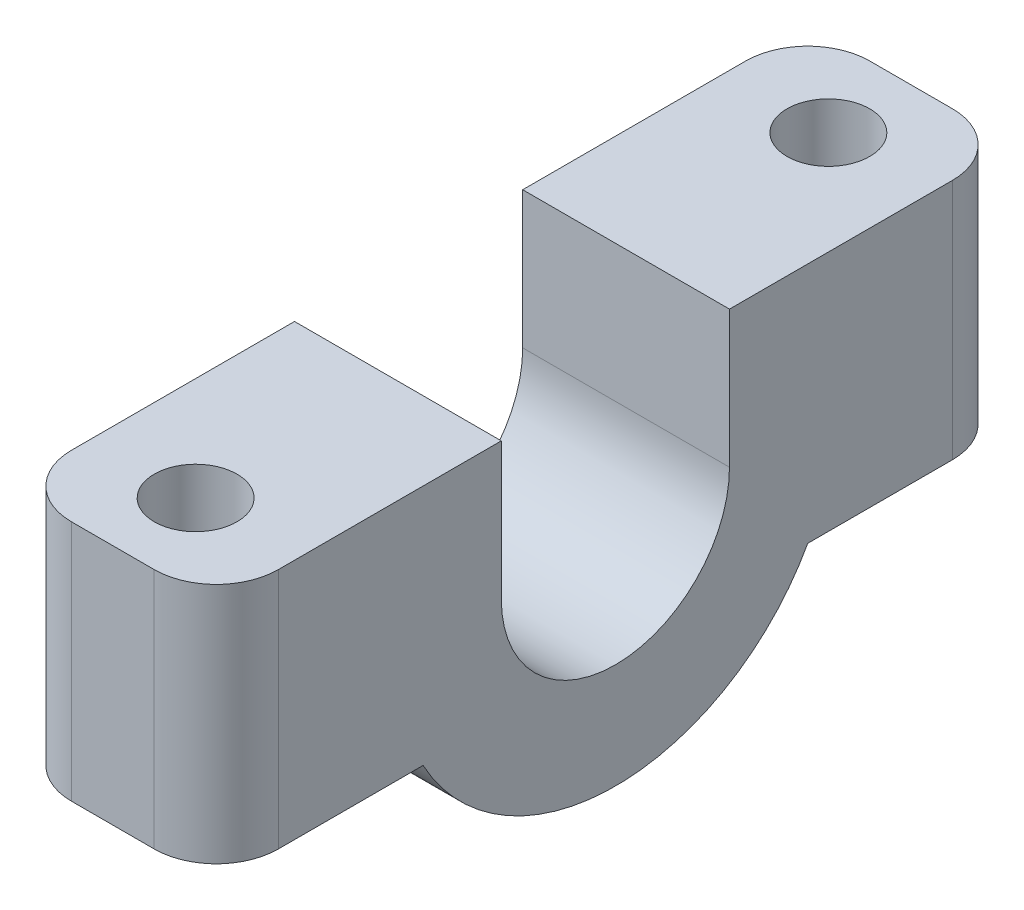
from build123d import *

# Parameters (mm, degrees)
BOSS_EXTRUDE1_DEPTH = 20
CUT_EXTRUDE1_REACH  = 57.463
SKETCH3_R           = 4
FILLET1_R           = 6


with BuildPart() as part:
    # Sketch2 → Boss-Extrude1 (new body)
    with BuildSketch(Plane(origin=(0, 0, 0), x_dir=(0, 0, -1), z_dir=(1, 0, 0))):
        with BuildLine():
            Line((-18.601140422, -10.16), (-38.601140422, -10.16))
            Line((-38.601140422, -10.16), (-38.601140422, 0))
            Line((-38.601140422, 0), (-38.601140422, 13.245))
            Line((-38.601140422, 13.245), (-11.035, 13.245))
            Line((-11.035, 13.245), (-11.035, 0))
            ThreePointArc((-11.035, 0), (0, -11.035), (11.035, 0))
            Line((11.035, 0), (11.035, 13.245))
            Line((11.035, 13.245), (38.601140422, 13.245))
            Line((38.601140422, 13.245), (38.601140422, -10.16))
            Line((38.601140422, -10.16), (18.601140422, -10.16))
            ThreePointArc((18.601140422, -10.16), (0, -21.195), (-18.601140422, -10.16))
        make_face()
    extrude(amount=BOSS_EXTRUDE1_DEPTH)

    # Sketch3 → Cut-Extrude1 (cut, up to next)
    with BuildSketch(Plane(origin=(0, 13.245, 0), x_dir=(1, 0, 0), z_dir=(0, 1, 0)), mode=Mode.PRIVATE) as cut_extrude1_sk1:
        with Locations(Location((10, -30.6, 0), (0, 0, 270))):
            Circle(SKETCH3_R)
    cut_extrude1_tool1 = extrude(cut_extrude1_sk1.sketch, amount=-CUT_EXTRUDE1_REACH, mode=Mode.PRIVATE) & part.part
    # Sketch3 → Cut-Extrude1 (cut, up to next)
    with BuildSketch(Plane(origin=(0, 13.245, 0), x_dir=(1, 0, 0), z_dir=(0, 1, 0)), mode=Mode.PRIVATE) as cut_extrude1_sk2:
        with Locations(Location((10, 30.6, 0), (0, 0, 270))):
            Circle(SKETCH3_R)
    cut_extrude1_tool2 = extrude(cut_extrude1_sk2.sketch, amount=-CUT_EXTRUDE1_REACH, mode=Mode.PRIVATE) & part.part
    add(cut_extrude1_tool1.solids().sort_by_distance((10, 13.245, 30.6))[0], mode=Mode.SUBTRACT)
    add(cut_extrude1_tool2.solids().sort_by_distance((10, 13.245, -30.6))[0], mode=Mode.SUBTRACT)

    # Fillet1
    fillet1_edges = [part.edges().sort_by_distance(p)[0] for p in [
        (0, 1.5425, -38.601140422),
        (0, 1.5425, 38.601140422),
        (20, 1.5425, 38.601140422),
        (20, 1.5425, -38.601140422),
    ]]
    fillet(fillet1_edges, radius=FILLET1_R)


solid = part.part
